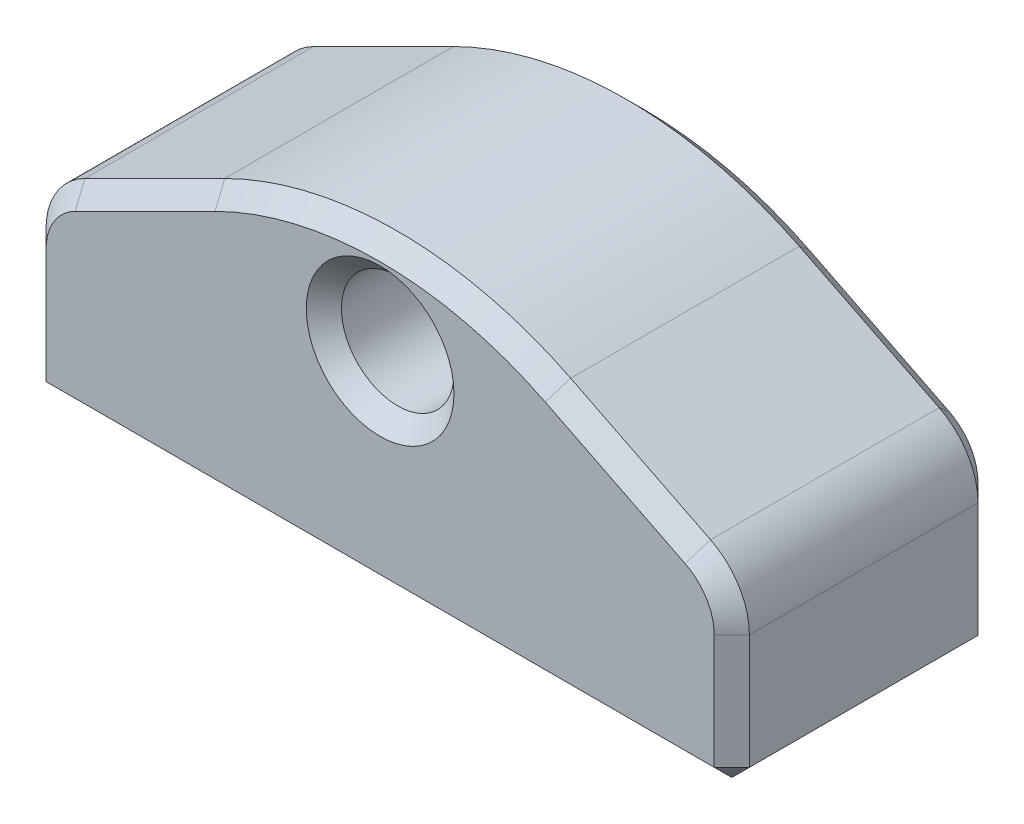
from build123d import *

# Parameters (mm, degrees)
SKETCH1_W           = 25.4
SKETCH1_H           = 9.525
BOSS_EXTRUDE1_DEPTH = 12.7
SKETCH1_3_R         = 2.032
CUT_EXTRUDE1_DEPTH  = 4.7625
SKETCH3_R           = 2.032
CUT_EXTRUDE2_DEPTH  = 21.329919454
FILLET1_R           = 13.97
FILLET2_R           = 2.54
CHAMFER1_SIZE       = 0.635
CHAMFER2_SIZE       = 0.635
CHAMFER3_SIZE       = 0.635


with BuildPart() as part:
    # Sketch1 → Boss-Extrude1 (new body)
    with BuildSketch(Plane(origin=(0, 0, 0), x_dir=(1, 0, 0), z_dir=(0, 1, 0))):
        Rectangle(SKETCH1_W, SKETCH1_H)
    extrude(amount=BOSS_EXTRUDE1_DEPTH)

    # Sketch1<3> → Cut-Extrude1 (cut)
    with BuildSketch(Plane(origin=(0, 0, 0), x_dir=(1, 0, 0), z_dir=(0, 1, 0))):
        with Locations(Location((-6.35, 0, 0), (0, 0, 90))):
            Circle(SKETCH1_3_R)
        with Locations(Location((6.35, 0, 0), (0, 0, 90))):
            Circle(SKETCH1_3_R)
    extrude(amount=CUT_EXTRUDE1_DEPTH, mode=Mode.SUBTRACT)

    # Sketch3 → Cut-Extrude2 (cut, through all)
    with BuildSketch(Plane.XY.offset(4.7625)):
        Polygon((-12.7, 12.7), (-12.7, 6.35), (0, 12.7), align=None)
        Polygon((12.7, 12.7), (0, 12.7), (12.7, 6.35), align=None)
        with Locations((0, 7.62)):
            Circle(SKETCH3_R)
    extrude(amount=-CUT_EXTRUDE2_DEPTH, mode=Mode.SUBTRACT)

    # Fillet1
    fillet1_edges = [part.edges().sort_by_distance(p)[0] for p in [
        (0, 12.7, 0),
    ]]
    fillet(fillet1_edges, radius=FILLET1_R)

    # Fillet2
    fillet2_edges = [part.edges().sort_by_distance(p)[0] for p in [
        (-12.7, 6.35, 0),
        (12.7, 6.35, 0),
    ]]
    fillet(fillet2_edges, radius=FILLET2_R)

    # Chamfer1
    chamfer1_edges = [part.edges().sort_by_distance(p)[0] for p in [
        (-2.032, 7.62, -4.7625),
        (-2.032, 7.62, 4.7625),
    ]]
    chamfer(chamfer1_edges, length=CHAMFER1_SIZE)

    # Chamfer2
    chamfer2_edges = [part.edges().sort_by_distance(p)[0] for p in [
        (-6.35, 0, 2.032),
        (6.35, 0, 2.032),
    ]]
    chamfer(chamfer2_edges, length=CHAMFER2_SIZE)

    # Chamfer3
    chamfer3_edges = [part.edges().sort_by_distance(p)[0] for p in [
        (8.771748231, 8.314125885, 4.7625),
        (8.771748231, 8.314125885, -4.7625),
        (0, 0, -4.7625),
        (0, 11.051065177, 4.7625),
        (0, 11.051065177, -4.7625),
        (-12.7, 0, 0),
        (12.7, 2.390096834, -4.7625),
        (12.7, 2.390096834, 4.7625),
        (-8.771748231, 8.314125885, 4.7625),
        (-12.7, 2.390096834, 4.7625),
        (-12.320653053, 6.115550693, 4.7625),
        (0, 0, 4.7625),
        (12.320653053, 6.115550693, 4.7625),
        (-8.771748231, 8.314125885, -4.7625),
        (-12.7, 2.390096834, -4.7625),
        (-12.320653053, 6.115550693, -4.7625),
        (12.320653053, 6.115550693, -4.7625),
        (12.7, 0, 0),
    ]]
    chamfer(chamfer3_edges, length=CHAMFER3_SIZE)


solid = part.part
